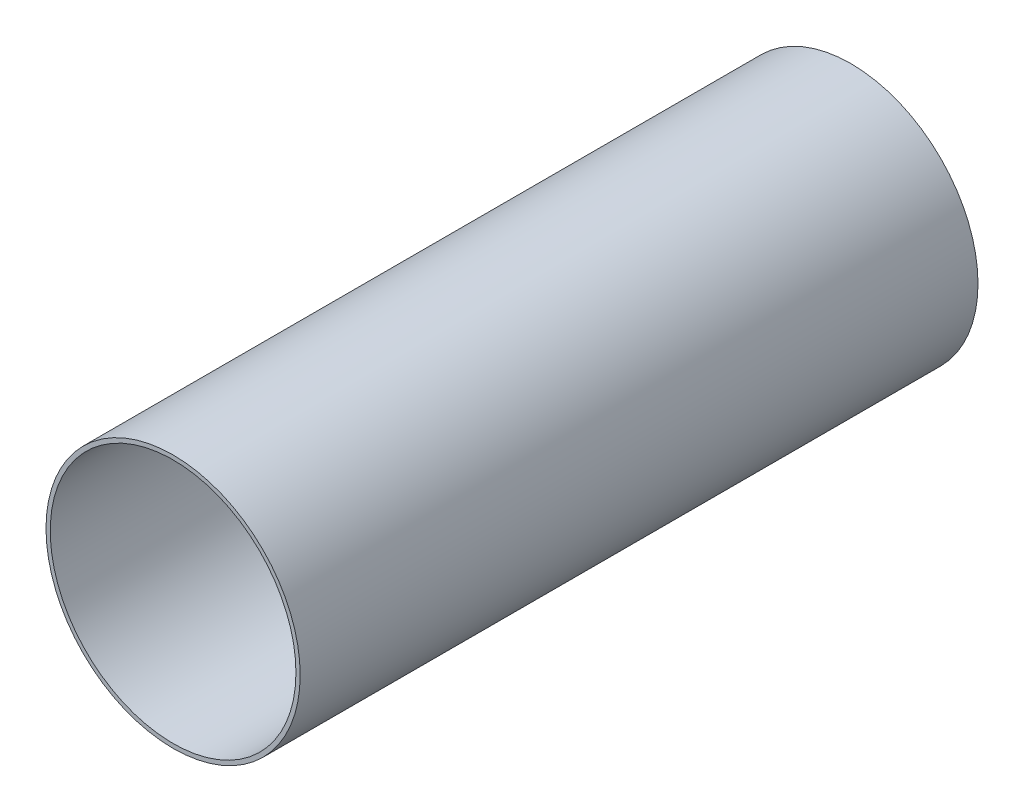
from build123d import *

# Parameters (mm, degrees)
SKETCH1_R           = 30
SKETCH1_R_2         = 29
BOSS_EXTRUDE1_DEPTH = 160


with BuildPart() as part:
    # Sketch1 → Boss-Extrude1 (new body)
    with BuildSketch(Plane.XY):
        Circle(SKETCH1_R)
        Circle(SKETCH1_R_2, mode=Mode.SUBTRACT)
    extrude(amount=BOSS_EXTRUDE1_DEPTH)


solid = part.part
